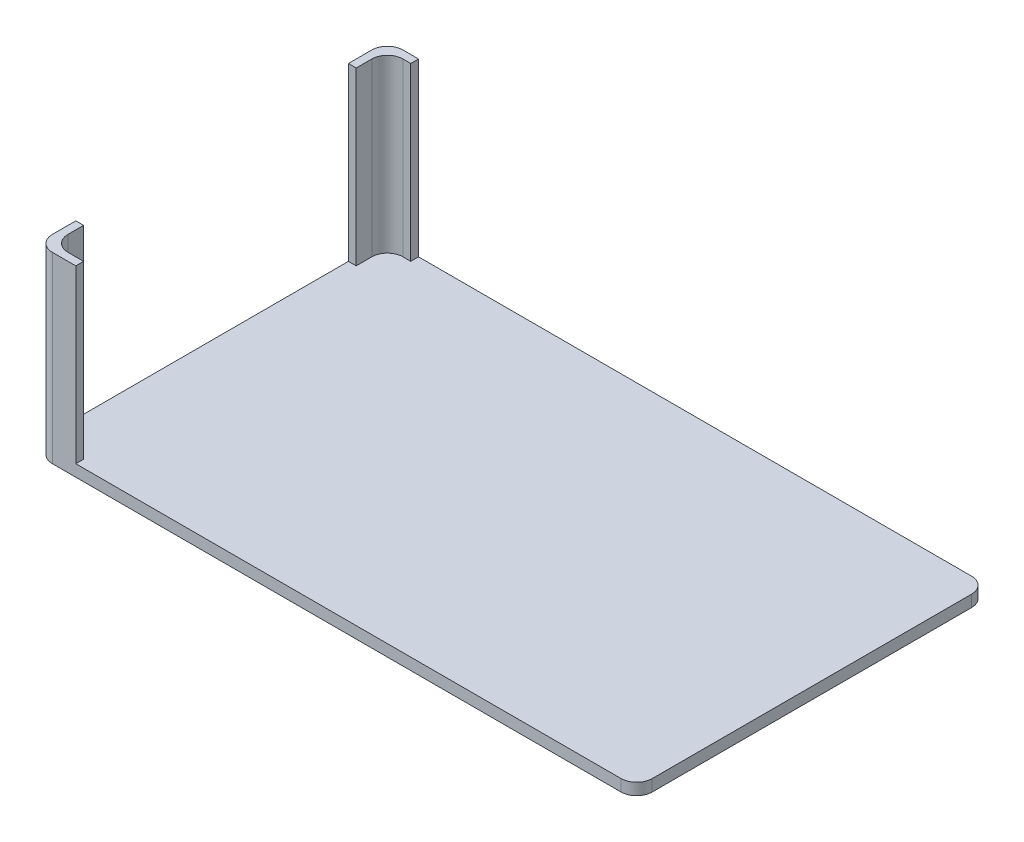
from build123d import *

# Parameters (mm, degrees)
EXTRUDE_1_DEPTH     = 23.5
EXTRUDE_2_DEPTH     = 1.5
SKETCH_6_W          = 1
SKETCH_6_H          = 35
SKETCH_6_W_2        = 69
SKETCH_6_H_2        = 1
SKETCH_6_W_3        = 67
SKETCH_6_H_3        = 37
CUT_EXTRUDE_1_DEPTH = 22
CUT_EXTRUDE_START   = -22
CUT_EXTRUDE_2_DEPTH = 22


with BuildPart() as part:
    # Эскиз3 → Бобышка-Вытянуть1 (new body)
    with BuildSketch(Plane(origin=(0, 0, 0), x_dir=(1, 0, 0), z_dir=(0, 1, 0))):
        with BuildLine():
            Line((-36, 16), (37, 16))
            ThreePointArc((37, 16), (38.414213562, 15.414213562), (39, 14))
            Line((39, 14), (39, -27))
            ThreePointArc((39, -27), (38.414213562, -28.414213562), (37, -29))
            Line((37, -29), (-36, -29))
            ThreePointArc((-36, -29), (-37.414213562, -28.414213562), (-38, -27))
            Line((-38, -27), (-38, 14))
            ThreePointArc((-38, 14), (-37.414213562, 15.414213562), (-36, 16))
        make_face()
        with BuildLine():
            Line((-35, -28), (36, -28))
            ThreePointArc((36, -28), (37.414213562, -27.414213562), (38, -26))
            Line((38, -26), (38, 13))
            ThreePointArc((38, 13), (37.414213562, 14.414213562), (36, 15))
            Line((36, 15), (-35, 15))
            ThreePointArc((-35, 15), (-36.414213562, 14.414213562), (-37, 13))
            Line((-37, 13), (-37, -26))
            ThreePointArc((-37, -26), (-36.414213562, -27.414213562), (-35, -28))
        make_face(mode=Mode.SUBTRACT)
    extrude(amount=EXTRUDE_1_DEPTH)

    # Эскиз3<3> → Бобышка-Вытянуть2 (add)
    with BuildSketch(Plane(origin=(0, 0, 0), x_dir=(1, 0, 0), z_dir=(0, 1, 0))):
        with BuildLine():
            Line((35, 16), (-34, 16))
            Line((-34, 16), (-34, 15))
            Line((-34, 15), (-35, 15))
            ThreePointArc((-35, 15), (-36.414213562, 14.414213562), (-37, 13))
            Line((-37, 13), (-37, 11))
            Line((-37, 11), (-38, 11))
            Line((-38, 11), (-38, -24))
            Line((-38, -24), (-37, -24))
            Line((-37, -24), (-37, -26))
            ThreePointArc((-37, -26), (-36.414213562, -27.414213562), (-35, -28))
            Line((-35, -28), (-33, -28))
            Line((-33, -28), (-33, -29))
            Line((-33, -29), (34, -29))
            Line((34, -29), (34, -28))
            Line((34, -28), (36, -28))
            ThreePointArc((36, -28), (37.414213562, -27.414213562), (38, -26))
            Line((38, -26), (38, -25))
            Line((38, -25), (39, -25))
            Line((39, -25), (39, 12))
            Line((39, 12), (38, 12))
            Line((38, 12), (38, 13))
            ThreePointArc((38, 13), (37.414213562, 14.414213562), (36, 15))
            Line((36, 15), (35, 15))
            Line((35, 15), (35, 16))
        make_face()
    extrude(amount=EXTRUDE_2_DEPTH)

    # Эскиз6 → Вырез-Вытянуть1 (cut)
    with BuildSketch(Plane(origin=(0, 23.5, 0), x_dir=(1, 0, 0), z_dir=(0, 1, 0))):
        with Locations((-37.5, -6.5)):
            Rectangle(SKETCH_6_W, SKETCH_6_H)
        with Locations((0.5, 15.5)):
            Rectangle(SKETCH_6_W_2, SKETCH_6_H_2)
        with Locations((0.5, -28.5)):
            Rectangle(SKETCH_6_W_3, SKETCH_6_H_2)
        with Locations((38.5, -6.5)):
            Rectangle(SKETCH_6_W, SKETCH_6_H_3)
    extrude(amount=-CUT_EXTRUDE_1_DEPTH, mode=Mode.SUBTRACT)

    # Эскиз9 → Вырез-Вытянуть2 (cut)
    with BuildSketch(Plane(origin=(0, 23.5, 0), x_dir=(1, 0, 0), z_dir=(0, 1, 0)).offset(CUT_EXTRUDE_START)):
        with BuildLine():
            Line((38, 12), (39, 12))
            Line((39, 12), (39, 14))
            ThreePointArc((39, 14), (38.414213562, 15.414213562), (37, 16))
            Line((37, 16), (35, 16))
            Line((35, 16), (35, 15))
            Line((35, 15), (36, 15))
            ThreePointArc((36, 15), (37.414213562, 14.414213562), (38, 13))
            Line((38, 13), (38, 12))
        make_face()
        with BuildLine():
            Line((39, -27), (39, -25))
            Line((39, -25), (38, -25))
            Line((38, -25), (38, -26))
            ThreePointArc((38, -26), (37.414213562, -27.414213562), (36, -28))
            Line((36, -28), (34, -28))
            Line((34, -28), (34, -29))
            Line((34, -29), (37, -29))
            ThreePointArc((37, -29), (38.414213562, -28.414213562), (39, -27))
        make_face()
    extrude(amount=CUT_EXTRUDE_2_DEPTH, mode=Mode.SUBTRACT)


solid = part.part
